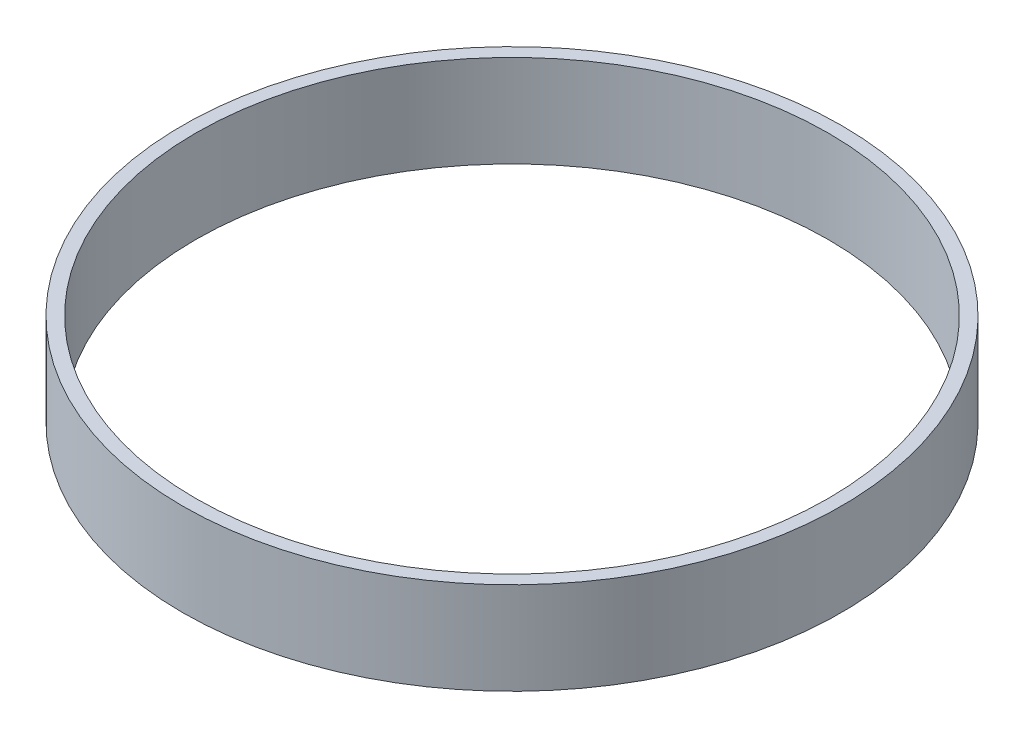
from build123d import *

# Parameters (mm, degrees)
SKETCH1_R           = 75
SKETCH1_R_2         = 72
BOSS_EXTRUDE1_DEPTH = 21


with BuildPart() as part:
    # Sketch1 → Boss-Extrude1 (new body)
    with BuildSketch(Plane(origin=(0, 0, 0), x_dir=(1, 0, 0), z_dir=(0, 1, 0))):
        with Locations(Location((0, 0, 0), (0, 0, 90))):
            Circle(SKETCH1_R)
        with Locations(Location((0, 0, 0), (0, 0, 90))):
            Circle(SKETCH1_R_2, mode=Mode.SUBTRACT)
    extrude(amount=BOSS_EXTRUDE1_DEPTH)


solid = part.part
